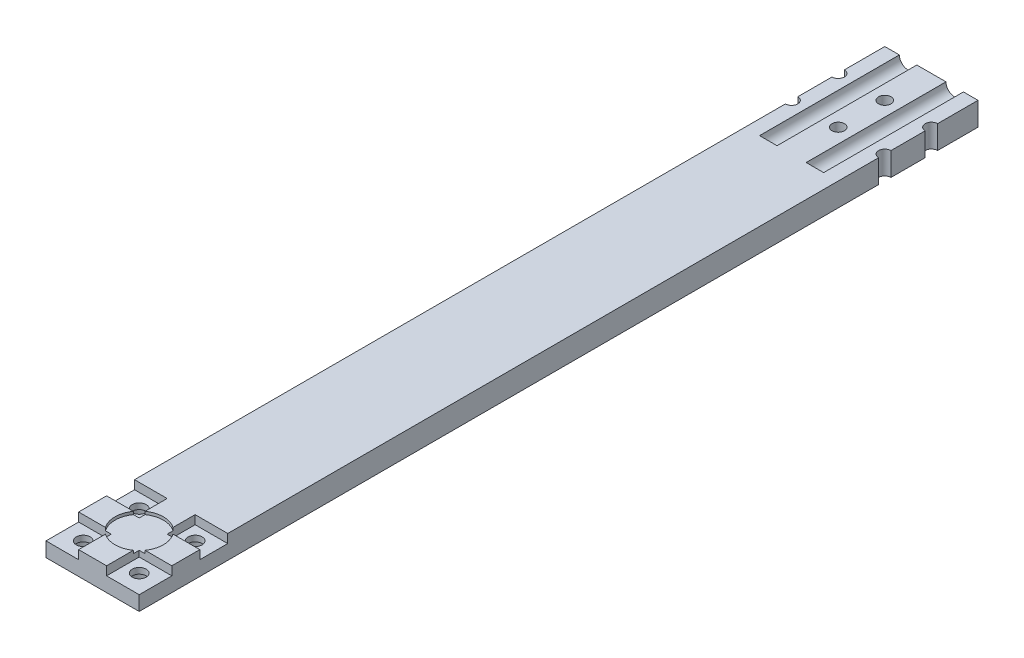
from build123d import *

# Parameters (mm, degrees)
SKETCH1_W               = 50.8
SKETCH1_H               = 457.2
BOSS_EXTRUDE1_DEPTH     = 12.7
SKETCH2_R               = 4.7625
CUT_EXTRUDE1_DEPTH      = 76.2
F_1_4_CLEARANCE_HOLE1_D = 6.7564
SKETCH11_R              = 13.208
CUT_EXTRUDE2_DEPTH      = 1.5875
SKETCH13_R              = 3.81
CUT_EXTRUDE3_DEPTH      = 231.35713577
SKETCH15_W              = 17.78
SKETCH15_H              = 15.24
SKETCH15_H_2            = 17.78
CUT_EXTRUDE4_DEPTH      = 4.7625
SKETCH16_R              = 6.858
CUT_EXTRUDE5_DEPTH      = 4.7625


with BuildPart() as part:
    # Sketch1 → Boss-Extrude1 (new body)
    with BuildSketch(Plane(origin=(0, 0, 0), x_dir=(1, 0, 0), z_dir=(0, 1, 0))):
        Rectangle(SKETCH1_W, SKETCH1_H)
    extrude(amount=BOSS_EXTRUDE1_DEPTH)

    # Sketch2 → Cut-Extrude1 (cut)
    with BuildSketch(Plane(origin=(0, 0, -228.6), x_dir=(-1, 0, 0), z_dir=(0, 0, -1))):
        with Locations((-12.7, 12.7)):
            Circle(SKETCH2_R)
        with Locations((12.7, 12.7)):
            Circle(SKETCH2_R)
        with Locations((-12.7, 0)):
            Circle(SKETCH2_R)
        with Locations((12.7, 0)):
            Circle(SKETCH2_R)
    extrude(amount=-CUT_EXTRUDE1_DEPTH, mode=Mode.SUBTRACT)

    # 1/4 Clearance Hole1 (through all)
    with Locations(Plane(origin=(0, 12.7, 0), x_dir=(1, 0, 0), z_dir=(0, 1, 0))):
        with Locations((0, 203.2), (0, 177.8), (25.4, 203.2), (25.4, 177.8), (-25.4, 177.8), (-25.4, 203.2)):
            Hole(F_1_4_CLEARANCE_HOLE1_D / 2)

    # Sketch11 → Cut-Extrude2 (cut)
    with BuildSketch(Plane(origin=(0, 12.7, 0), x_dir=(1, 0, 0), z_dir=(0, 1, 0))):
        with Locations(Location((0, -203.2, 0), (0, 0, 270))):
            Circle(SKETCH11_R)
    extrude(amount=-CUT_EXTRUDE2_DEPTH, mode=Mode.SUBTRACT)

    # Sketch13 → Cut-Extrude3 (cut, through all)
    with BuildSketch(Plane(origin=(0, 12.7, 0), x_dir=(1, 0, 0), z_dir=(0, 1, 0))):
        with Locations(Location((-15.24, -187.96, 0), (0, 0, 270))):
            Circle(SKETCH13_R)
        with Locations(Location((15.24, -187.96, 0), (0, 0, 270))):
            Circle(SKETCH13_R)
        with Locations(Location((15.24, -218.44, 0), (0, 0, 270))):
            Circle(SKETCH13_R)
        with Locations(Location((-15.24, -218.44, 0), (0, 0, 270))):
            Circle(SKETCH13_R)
    extrude(amount=-CUT_EXTRUDE3_DEPTH, mode=Mode.SUBTRACT)

    # Sketch15 → Cut-Extrude4 (cut)
    with BuildSketch(Plane(origin=(0, 12.7, 0), x_dir=(1, 0, 0), z_dir=(0, 1, 0))):
        with Locations((-16.51, -187.96)):
            Rectangle(SKETCH15_W, SKETCH15_H)
        with Locations((16.51, -187.96)):
            Rectangle(SKETCH15_W, SKETCH15_H)
        with Locations((-16.51, -219.71)):
            Rectangle(SKETCH15_W, SKETCH15_H_2)
        with Locations((16.51, -219.71)):
            Rectangle(SKETCH15_W, SKETCH15_H_2)
    extrude(amount=-CUT_EXTRUDE4_DEPTH, mode=Mode.SUBTRACT)

    # Sketch16 → Cut-Extrude5 (cut)
    with BuildSketch(Plane.XZ):
        with Locations(Location((-15.24, 218.44, 0), (0, 0, 270))):
            Circle(SKETCH16_R)
        with Locations(Location((15.24, 218.44, 0), (0, 0, 270))):
            Circle(SKETCH16_R)
        with Locations(Location((15.24, 187.96, 0), (0, 0, 270))):
            Circle(SKETCH16_R)
        with Locations(Location((-15.24, 187.96, 0), (0, 0, 270))):
            Circle(SKETCH16_R)
    extrude(amount=-CUT_EXTRUDE5_DEPTH, mode=Mode.SUBTRACT)


solid = part.part
